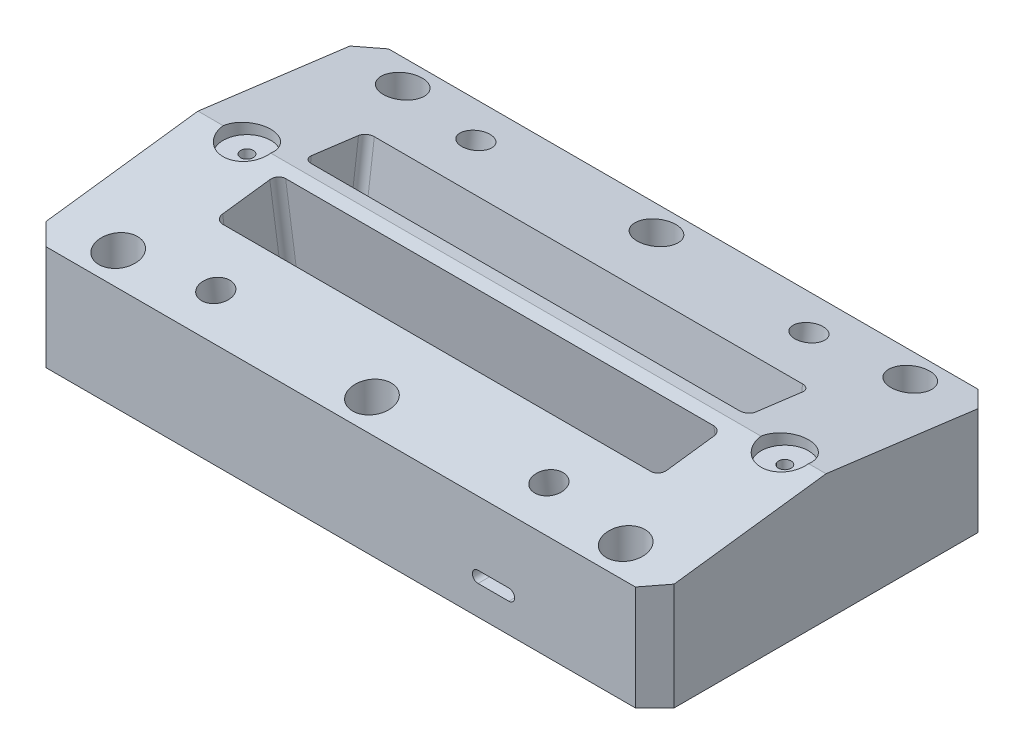
from build123d import *

# Parameters (mm, degrees)
SKETCH1_W            = 198
SKETCH1_H            = 108
BOSS_EXTRUDE1_DEPTH  = 40
SKETCH4_W            = 181
SKETCH4_H            = 45
CUT_EXTRUDE2_DEPTH   = 10
CUT_EXTRUDE3_START   = -198
CUT_EXTRUDE3_DEPTH   = 198
BOSS_EXTRUDE11_DEPTH = 10
CUT_EXTRUDE12_DEPTH  = 198
CUT_EXTRUDE28_DEPTH  = 14.5
CUT_EXTRUDE29_DEPTH  = 14.5
CUT_EXTRUDE40_REACH  = 231.059
SKETCH12_R           = 3.15
CUT_EXTRUDE9_DEPTH   = 230.058944379
SKETCH13_R           = 4.5
CUT_EXTRUDE10_DEPTH  = 16.5
SKETCH14_R           = 4.5
CUT_EXTRUDE11_DEPTH  = 16.5
SKETCH41_R           = 2.9
CUT_EXTRUDE21_DEPTH  = 7
CUT_EXTRUDE22_DEPTH  = 10
CUT_EXTRUDE23_DEPTH  = 10
CUT_EXTRUDE35_DEPTH  = 55.4
CUT_EXTRUDE34_DEPTH  = 55.4
CUT_EXTRUDE36_DEPTH  = 55.4
SKETCH90_R           = 6.1
CUT_EXTRUDE38_DEPTH  = 17
SKETCH96_R           = 2
CUT_EXTRUDE39_DEPTH  = 230.058944379
SKETCH98_R           = 7.5
CUT_EXTRUDE41_DEPTH  = 4


with BuildPart() as part:
    # Sketch1 → Boss-Extrude1 (new body)
    with BuildSketch(Plane(origin=(0, 0, 0), x_dir=(1, 0, 0), z_dir=(0, 1, 0))):
        with Locations((99, 54)):
            Rectangle(SKETCH1_W, SKETCH1_H)
    extrude(amount=BOSS_EXTRUDE1_DEPTH)

    # Sketch4 → Cut-Extrude2 (cut)
    with BuildSketch(Plane(origin=(0, 0, 0), x_dir=(1, 0, 0), z_dir=(0, 1, 0))):
        with Locations((99, 54)):
            Rectangle(SKETCH4_W, SKETCH4_H)
    extrude(amount=CUT_EXTRUDE2_DEPTH, mode=Mode.SUBTRACT)

    # Sketch5 → Cut-Extrude3 (cut)
    with BuildSketch(Plane(origin=(198, 0, 0), x_dir=(0, 0, -1), z_dir=(1, 0, 0)).offset(CUT_EXTRUDE3_START)):
        Polygon((54, 40), (108, 33.034537882), (108, 40), align=None)
    extrude(amount=CUT_EXTRUDE3_DEPTH, mode=Mode.SUBTRACT)

    # Sketch53 → Boss-Extrude11 (add)
    with BuildSketch(Plane(origin=(0, 10, 0), x_dir=(-1, 0, 0), z_dir=(0, -1, 0))):
        Polygon((-8.5, 51.5), (-8.5, 31.5), (-39.5, 31.5), align=None)
        Polygon((-8.5, 56.5), (-8.5, 76.5), (-39.5, 76.5), align=None)
        Polygon((-158.5, 76.5), (-189.5, 56.5), (-189.5, 76.5), align=None)
        Polygon((-158.5, 31.5), (-189.5, 51.5), (-189.5, 31.5), align=None)
    extrude(amount=BOSS_EXTRUDE11_DEPTH)

    # Sketch18 → Cut-Extrude12 (cut)
    with BuildSketch(Plane(origin=(198, 0, 0), x_dir=(0, 0, -1), z_dir=(1, 0, 0))):
        Polygon((0, 33.034537882), (0, 40), (54, 40), align=None)
    extrude(amount=-CUT_EXTRUDE12_DEPTH, mode=Mode.SUBTRACT)

    # Izq → Cut-Extrude28 (cut)
    with BuildSketch(Plane(origin=(0, 28.012686094, -12.204810084), x_dir=(1, 0, 0), z_dir=(0, 0.9167660546215652, -0.39942458749256926))):
        Polygon((8.5, 48.862182113), (29.5, 70.132603179), (8.5, 70.132603179), align=None)
    cut_extrude28 = extrude(amount=-CUT_EXTRUDE28_DEPTH, mode=Mode.SUBTRACT)

    # Der → Cut-Extrude29 (cut)
    with BuildSketch(Plane(origin=(0, -11.144923858, -4.62106599), x_dir=(1, 0, 0), z_dir=(0, 0.9237421135716327, 0.38301502270043264))):
        Polygon((8.5, 51.290217599), (29.5, 29.097876578), (8.5, 29.097876578), align=None)
    cut_extrude29 = extrude(amount=-CUT_EXTRUDE29_DEPTH, mode=Mode.SUBTRACT)

    # Cut-Extrude40: up to this face of the body (flat: up to its plane)
    cut_extrude40_end = Plane(part.part.faces().sort_by_distance((99, 10, -54))[0])
    # Sketch97 → Cut-Extrude40 (cut, up to the picked face)
    with BuildSketch(Plane(origin=(0, 0, 0), x_dir=(1, 0, 0), z_dir=(0, 1, 0)), mode=Mode.PRIVATE) as cut_extrude40_sk1:
        Polygon((8.5, 57.5), (29.5, 76.5), (158.5, 76.5), (189.5, 56.5), (189.5, 51.5), (158.5, 31.5), (29.5, 31.5), (8.5, 51.5), align=None)
    cut_extrude40_tool1 = split(extrude(cut_extrude40_sk1.sketch, amount=CUT_EXTRUDE40_REACH, mode=Mode.PRIVATE), bisect_by=cut_extrude40_end, keep=Keep.BOTH, mode=Mode.PRIVATE)
    cut_extrude40 = cut_extrude40_tool1.solids().sort_by(Axis((96.82024, 0, -54.014019), (0, 1, 0)))[0]
    add(cut_extrude40, mode=Mode.SUBTRACT)

    # Mirror2: Cut-Extrude28, Cut-Extrude29, Cut-Extrude40 across plane
    add(cut_extrude28.mirror(Plane(origin=(99, 0, 0), x_dir=(0, 0, 1), z_dir=(1, 0, 0))), mode=Mode.SUBTRACT)
    add(cut_extrude29.mirror(Plane(origin=(99, 0, 0), x_dir=(0, 0, 1), z_dir=(1, 0, 0))), mode=Mode.SUBTRACT)
    add(cut_extrude40.mirror(Plane(origin=(99, 0, 0), x_dir=(0, 0, 1), z_dir=(1, 0, 0))), mode=Mode.SUBTRACT)

    # Sketch12 → Cut-Extrude9 (cut, through all)
    with BuildSketch(Plane(origin=(0, 40, 0), x_dir=(1, 0, 0), z_dir=(0, 1, 0))):
        with Locations(Location((19.7, 98.85, 0), (0, 0, 270))):
            Circle(SKETCH12_R)
        with Locations(Location((99.7, 9.15, 0), (0, 0, 270))):
            Circle(SKETCH12_R)
        with Locations(Location((179.7, 9.15, 0), (0, 0, 270))):
            Circle(SKETCH12_R)
        with Locations(Location((19.7, 9.15, 0), (0, 0, 270))):
            Circle(SKETCH12_R)
        with Locations(Location((99.7, 98.85, 0), (0, 0, 270))):
            Circle(SKETCH12_R)
        with Locations(Location((179.7, 98.85, 0), (0, 0, 270))):
            Circle(SKETCH12_R)
    extrude(amount=-CUT_EXTRUDE9_DEPTH, mode=Mode.SUBTRACT)

    # Sketch13 → Cut-Extrude10 (cut)
    with BuildSketch(Plane(origin=(0, 46.196819559, -5.958929567), x_dir=(1, 0, 0), z_dir=(0, 0.9917831801295787, -0.12793015130163748))):
        with Locations(Location((46.5, 89.886470025, 0), (0, 0, 270))):
            Circle(SKETCH13_R)
        with Locations(Location((151.5, 89.886470025, 0), (0, 0, 270))):
            Circle(SKETCH13_R)
    extrude(amount=-CUT_EXTRUDE10_DEPTH, mode=Mode.SUBTRACT)

    # Sketch14 → Cut-Extrude11 (cut)
    with BuildSketch(Plane(origin=(0, 32.118224468, 7.103753281), x_dir=(1, 0, 0), z_dir=(0, 0.9917831801295787, 0.1279301513016377))):
        with Locations(Location((46.5, 20.391498231, 0), (0, 0, 270))):
            Circle(SKETCH14_R)
        with Locations(Location((151.5, 20.391498231, 0), (0, 0, 270))):
            Circle(SKETCH14_R)
    extrude(amount=-CUT_EXTRUDE11_DEPTH, mode=Mode.SUBTRACT)

    # Sketch41 → Cut-Extrude21 (cut)
    with BuildSketch(Plane(origin=(0, 0, 0), x_dir=(1, 0, 0), z_dir=(0, 1, 0))):
        with Locations(Location((139.5, 9, 0), (0, 0, 90))):
            Circle(SKETCH41_R)
        with Locations(Location((139.5, 99, 0), (0, 0, 90))):
            Circle(SKETCH41_R)
    extrude(amount=CUT_EXTRUDE21_DEPTH, mode=Mode.SUBTRACT)

    # Sketch42 → Cut-Extrude22 (cut)
    with BuildSketch(Plane.XY):
        with BuildLine():
            Line((142.3, 12.8), (152, 12.8))
            ThreePointArc((152, 12.8), (153.8, 11), (152, 9.2))
            Line((152, 9.2), (142.3, 9.2))
            ThreePointArc((142.3, 9.2), (140.5, 11), (142.3, 12.8))
        make_face()
    extrude(amount=-CUT_EXTRUDE22_DEPTH, mode=Mode.SUBTRACT)

    # Sketch43 → Cut-Extrude23 (cut)
    with BuildSketch(Plane(origin=(0, 0, -108), x_dir=(-1, 0, 0), z_dir=(0, 0, -1))):
        with BuildLine():
            Line((-55.7, 12.8), (-46, 12.8))
            ThreePointArc((-46, 12.8), (-44.2, 11), (-46, 9.2))
            Line((-46, 9.2), (-55.7, 9.2))
            ThreePointArc((-55.7, 9.2), (-57.5, 11), (-55.7, 12.8))
        make_face()
    extrude(amount=-CUT_EXTRUDE23_DEPTH, mode=Mode.SUBTRACT)

    # Sketch84 → Cut-Extrude35 (cut)
    with BuildSketch(Plane(origin=(0, 46.196819559, -5.958929567), x_dir=(1, 0, 0), z_dir=(0, 0.9917831801295787, -0.12793015130163748))):
        with BuildLine():
            Line((31.7, 52.539085675), (166.7, 52.539085675))
            ThreePointArc((166.7, 52.539085675), (168.467766953, 53.271318722), (169.2, 55.039085675))
            Line((169.2, 55.039085675), (169.2, 70.039085675))
            ThreePointArc((169.2, 70.039085675), (168.467766953, 71.806852628), (166.7, 72.539085675))
            Line((166.7, 72.539085675), (31.7, 72.539085675))
            ThreePointArc((31.7, 72.539085675), (29.932233047, 71.806852628), (29.2, 70.039085675))
            Line((29.2, 70.039085675), (29.2, 55.039085675))
            ThreePointArc((29.2, 55.039085675), (29.932233047, 53.271318722), (31.7, 52.539085675))
        make_face()
    extrude(amount=-CUT_EXTRUDE35_DEPTH, mode=Mode.SUBTRACT)

    # Sketch83 → Cut-Extrude34 (cut)
    with BuildSketch(Plane(origin=(0, 32.493890552, 4.191388217), x_dir=(1, 0, 0), z_dir=(0, 0.9917831801295786, 0.12793015130163768))):
        with BuildLine():
            Line((31.7, 54.573497779), (166.7, 54.573497779))
            ThreePointArc((166.7, 54.573497779), (168.467766953, 53.841264732), (169.2, 52.073497779))
            Line((169.2, 52.073497779), (169.2, 37.073497779))
            ThreePointArc((169.2, 37.073497779), (168.467766953, 35.305730826), (166.7, 34.573497779))
            Line((166.7, 34.573497779), (31.7, 34.573497779))
            ThreePointArc((31.7, 34.573497779), (29.932233047, 35.305730826), (29.2, 37.073497779))
            Line((29.2, 37.073497779), (29.2, 52.073497779))
            ThreePointArc((29.2, 52.073497779), (29.932233047, 53.841264732), (31.7, 54.573497779))
        make_face()
    extrude(amount=-CUT_EXTRUDE34_DEPTH, mode=Mode.SUBTRACT)

    # Sketch85 → Cut-Extrude36 (cut)
    with BuildSketch(Plane(origin=(0, 40, 0), x_dir=(1, 0, 0), z_dir=(0, 1, 0))):
        Polygon((0, 101.9), (6.1, 108), (0, 108), align=None)
        Polygon((0, 0), (6.1, 0), (0, 6.1), align=None)
        Polygon((198, 6.1), (191.9, 0), (198, 0), align=None)
        Polygon((198, 108), (191.9, 108), (198, 101.9), align=None)
    extrude(amount=-CUT_EXTRUDE36_DEPTH, mode=Mode.SUBTRACT)

    # Sketch90 → Cut-Extrude38 (cut)
    with BuildSketch(Plane(origin=(0, 40, 0), x_dir=(1, 0, 0), z_dir=(0, 1, 0))):
        with Locations(Location((19.7, 9.15, 0), (0, 0, 270))):
            Circle(SKETCH90_R)
        with Locations(Location((99.7, 9.15, 0), (0, 0, 270))):
            Circle(SKETCH90_R)
        with Locations(Location((179.7, 9.15, 0), (0, 0, 270))):
            Circle(SKETCH90_R)
        with Locations(Location((99.7, 98.85, 0), (0, 0, 270))):
            Circle(SKETCH90_R)
        with Locations(Location((179.7, 98.85, 0), (0, 0, 270))):
            Circle(SKETCH90_R)
        with Locations(Location((19.7, 98.85, 0), (0, 0, 270))):
            Circle(SKETCH90_R)
    extrude(amount=-CUT_EXTRUDE38_DEPTH, mode=Mode.SUBTRACT)

    # Sketch96 → Cut-Extrude39 (cut, through all)
    with BuildSketch(Plane(origin=(0, 0, 0), x_dir=(1, 0, 0), z_dir=(0, 1, 0))):
        with Locations(Location((15.45, 54, 0), (0, 0, 180))):
            Circle(SKETCH96_R)
        with Locations((185, 54)):
            Circle(SKETCH96_R)
    extrude(amount=CUT_EXTRUDE39_DEPTH, mode=Mode.SUBTRACT)

    # Sketch98 → Cut-Extrude41 (cut)
    with BuildSketch(Plane(origin=(0, 40, 0), x_dir=(1, 0, 0), z_dir=(0, 1, 0))):
        with Locations(Location((185, 54, 0), (0, 0, 270))):
            Circle(SKETCH98_R)
        with Locations(Location((15.45, 54, 0), (0, 0, 270))):
            Circle(SKETCH98_R)
    extrude(amount=-CUT_EXTRUDE41_DEPTH, mode=Mode.SUBTRACT)


solid = part.part
